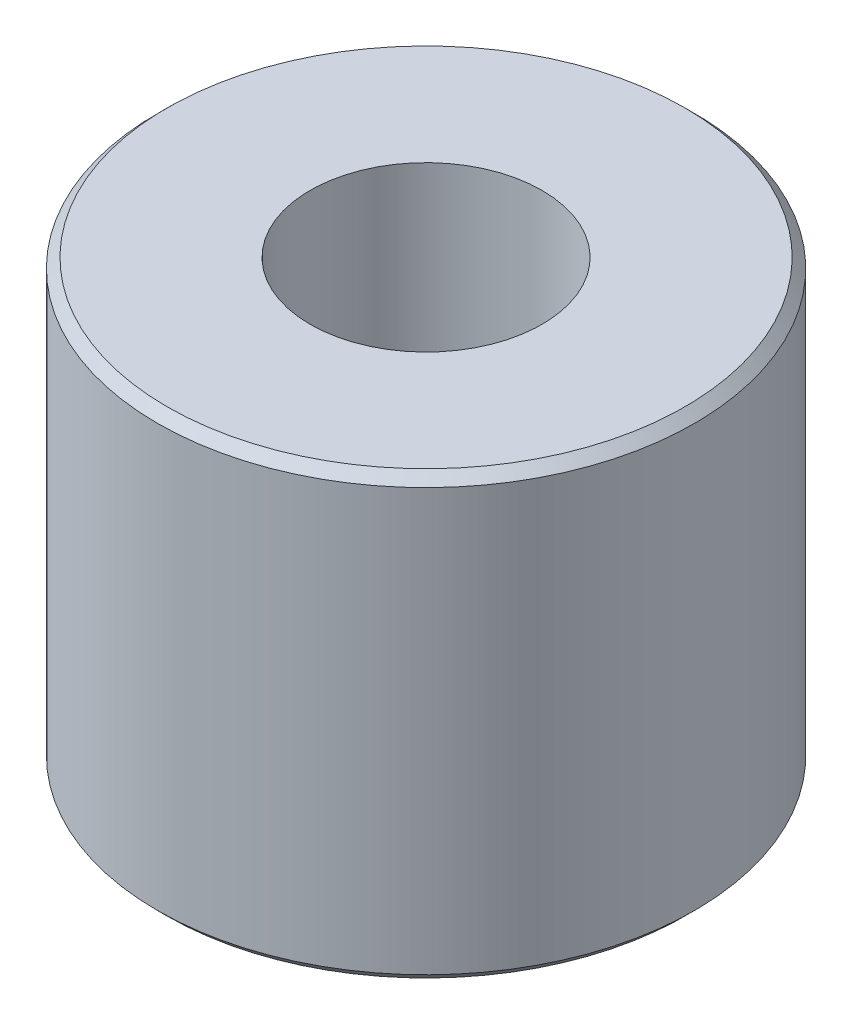
from build123d import *

# Parameters (mm, degrees)
SKETCH2_R           = 14
BOSS_EXTRUDE1_DEPTH = 23
SKETCH3_R           = 6.05
CUT_EXTRUDE1_DEPTH  = 31.347981811
CHAMFER1_SIZE       = 0.5


with BuildPart() as part:
    # Sketch2 → Boss-Extrude1 (new body)
    with BuildSketch(Plane(origin=(0, 0, 0), x_dir=(1, 0, 0), z_dir=(0, 1, 0))):
        with Locations(Location((0, 0, 0), (0, 0, 270))):
            Circle(SKETCH2_R)
    extrude(amount=BOSS_EXTRUDE1_DEPTH)

    # Sketch3 → Cut-Extrude1 (cut, through all)
    with BuildSketch(Plane(origin=(0, 23, 0), x_dir=(1, 0, 0), z_dir=(0, 1, 0))):
        with Locations(Location((0, 0, 0), (0, 0, 270))):
            Circle(SKETCH3_R)
    extrude(amount=-CUT_EXTRUDE1_DEPTH, mode=Mode.SUBTRACT)

    # Chamfer1
    chamfer1_edges = [part.edges().sort_by_distance(p)[0] for p in [
        (0, 0, -14),
        (0, 23, -14),
    ]]
    chamfer(chamfer1_edges, length=CHAMFER1_SIZE)


solid = part.part
